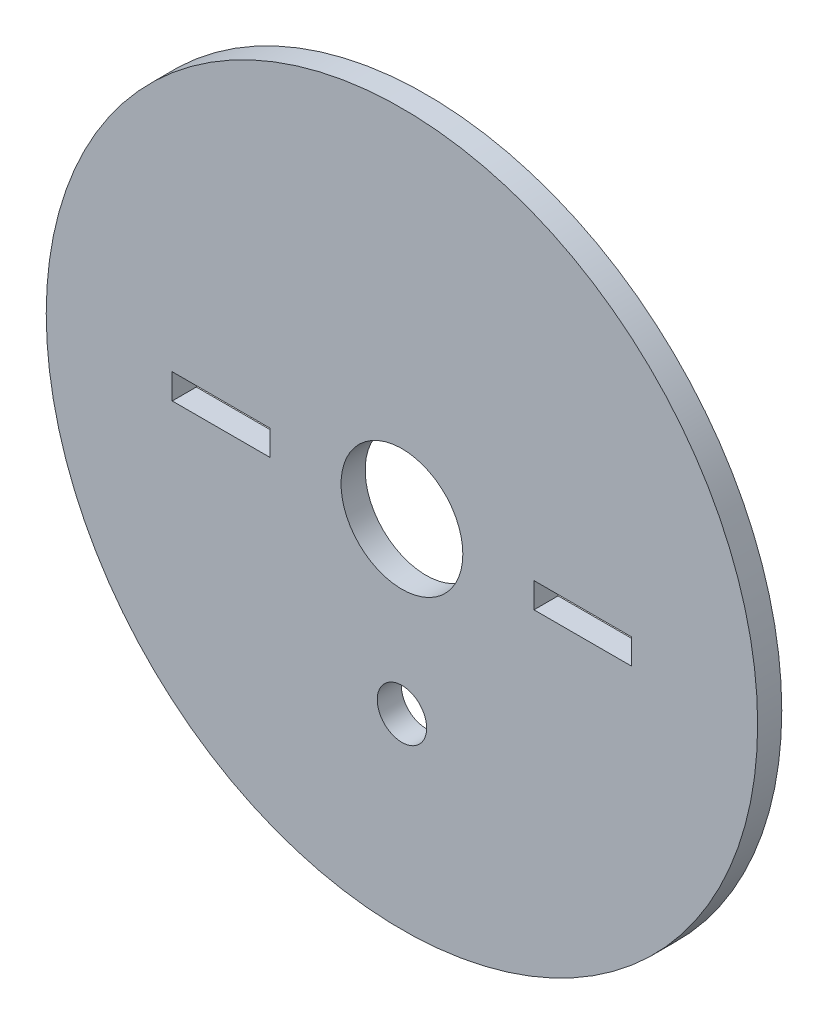
from build123d import *

# Parameters (mm, degrees)
SKETCH_1_R      = 29.5
SKETCH_1_R_2    = 2.05
SKETCH_1_R_3    = 5.05
SKETCH_1_W      = 8.1
SKETCH_1_H      = 2.1
EXTRUDE_1_DEPTH = 2


with BuildPart() as part:
    # 草图1 → 凸台-拉伸1 (new body)
    with BuildSketch(Plane.XY):
        with Locations((0, 14)):
            Circle(SKETCH_1_R)
        Circle(SKETCH_1_R_2, mode=Mode.SUBTRACT)
        with Locations((0, 14)):
            Circle(SKETCH_1_R_3, mode=Mode.SUBTRACT)
        with Locations((-15, 14)):
            Rectangle(SKETCH_1_W, SKETCH_1_H, mode=Mode.SUBTRACT)
        with Locations((15, 14)):
            Rectangle(SKETCH_1_W, SKETCH_1_H, mode=Mode.SUBTRACT)
    extrude(amount=EXTRUDE_1_DEPTH)


solid = part.part
